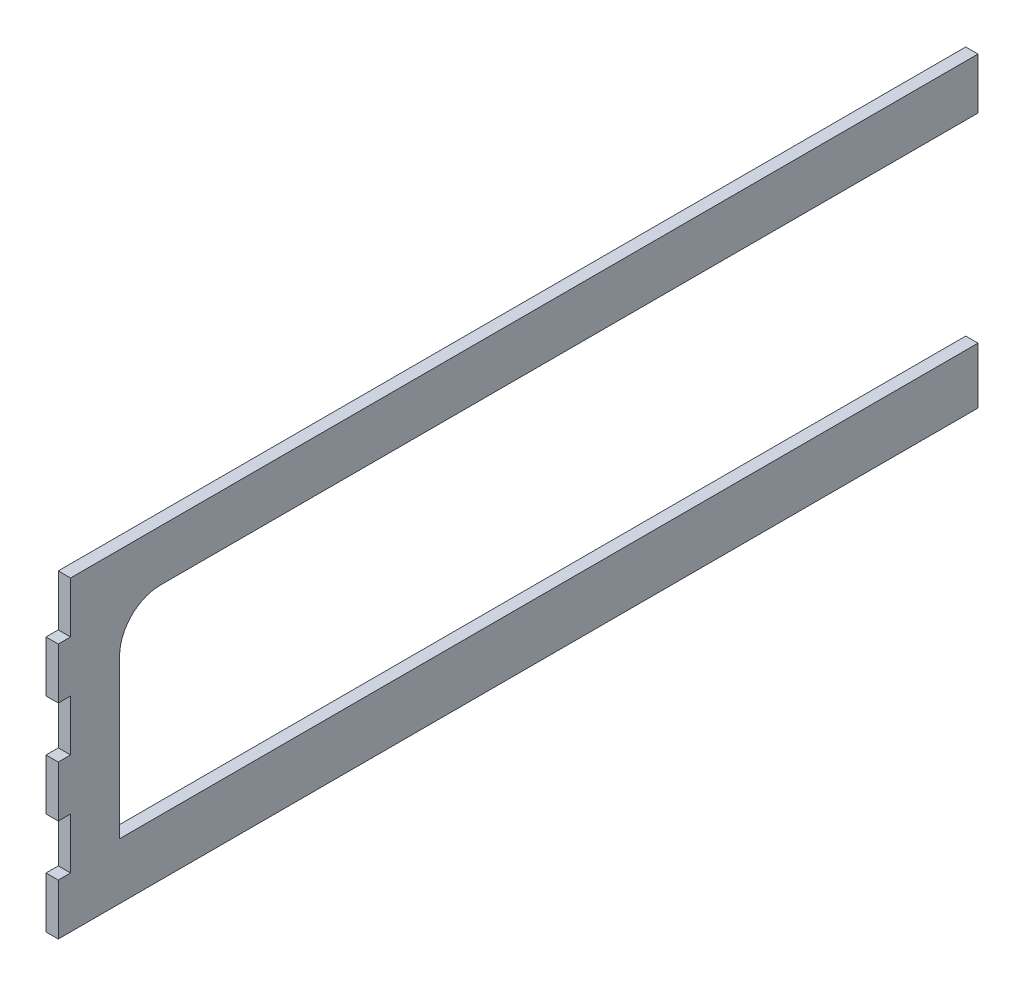
from build123d import *

# Parameters (mm, degrees)
BOSS_EXTRUDE1_DEPTH = 6
SKETCH2_W           = 6
SKETCH2_H           = 25
CUT_EXTRUDE1_DEPTH  = 6
LPATTERN1_COUNT     = 3
LPATTERN1_PITCH     = 50
FILLET1_R           = 20


with BuildPart() as part:
    # Sketch1 → Boss-Extrude1 (new body)
    with BuildSketch(Plane(origin=(0, 0, 0), x_dir=(0, 0, -1), z_dir=(1, 0, 0))):
        Polygon((450, 125), (450, 150), (0, 150), (0, 0), (450, 0), (450, 27.5), (30, 27.5), (30, 125), align=None)
    extrude(amount=BOSS_EXTRUDE1_DEPTH)

    # Sketch2 → Cut-Extrude1 (cut)
    with BuildSketch(Plane(origin=(6, 0, 0), x_dir=(0, 0, -1), z_dir=(1, 0, 0))):
        with Locations((3, 137.5)):
            Rectangle(SKETCH2_W, SKETCH2_H)
    cut_extrude1 = extrude(amount=-CUT_EXTRUDE1_DEPTH, mode=Mode.SUBTRACT)

    # LPattern1: Cut-Extrude1 ×3
    with Locations(*[(0, -i * LPATTERN1_PITCH, 0) for i in range(1, LPATTERN1_COUNT)]):
        add(cut_extrude1, mode=Mode.SUBTRACT)

    # Fillet1
    fillet1_edges = [part.edges().sort_by_distance(p)[0] for p in [
        (3, 125, -30),
    ]]
    fillet(fillet1_edges, radius=FILLET1_R)


solid = part.part
